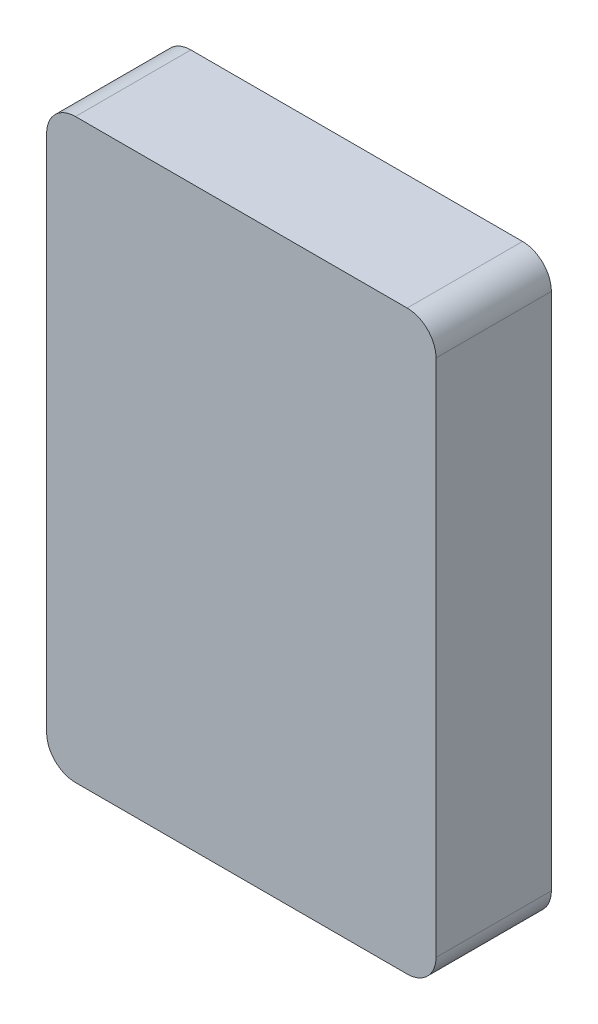
from build123d import *

# Parameters (mm, degrees)
SKETCH1_W           = 27
SKETCH1_H           = 40
BOSS_EXTRUDE1_DEPTH = 8
FILLET1_R           = 2


with BuildPart() as part:
    # Sketch1 → Boss-Extrude1 (new body)
    with BuildSketch(Plane.XY):
        Rectangle(SKETCH1_W, SKETCH1_H)
    extrude(amount=BOSS_EXTRUDE1_DEPTH)

    # Fillet1
    fillet1_edges = [part.edges().sort_by_distance(p)[0] for p in [
        (13.5, -20, 4),
        (-13.5, -20, 4),
        (-13.5, 20, 4),
        (13.5, 20, 4),
    ]]
    fillet(fillet1_edges, radius=FILLET1_R)


solid = part.part
